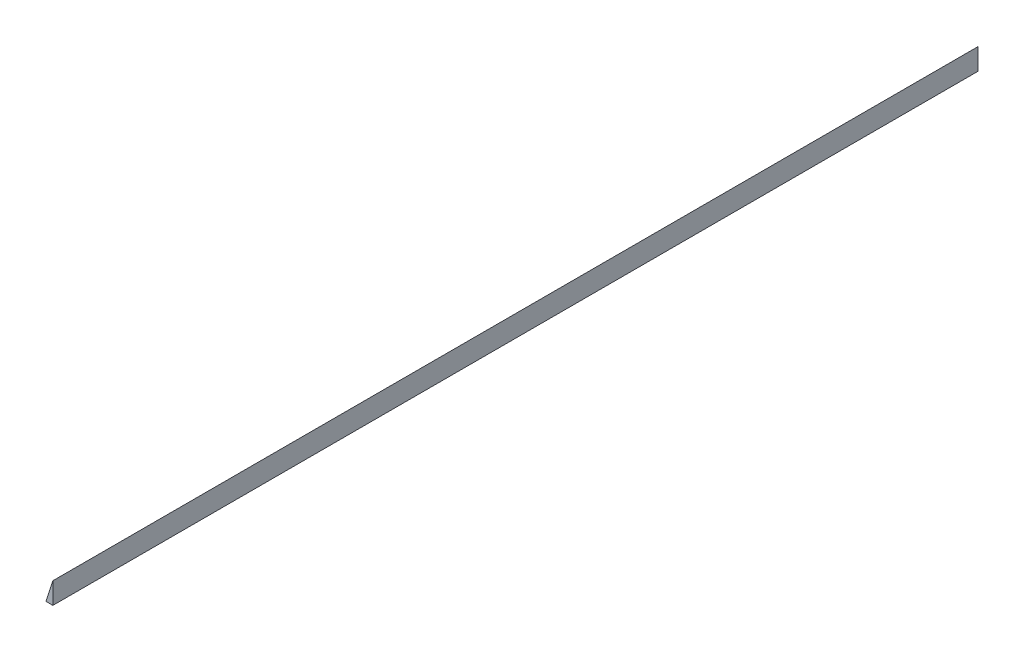
from build123d import *

# Parameters (mm, degrees)
BOSS_EXTRUDE1_DEPTH = 206


with BuildPart() as part:
    # Sketch1 → Boss-Extrude1 (new body)
    with BuildSketch(Plane.XY):
        Polygon((0, 0), (1.530490118, 4.76), (1.530490118, 0), align=None)
    extrude(amount=BOSS_EXTRUDE1_DEPTH)


solid = part.part
